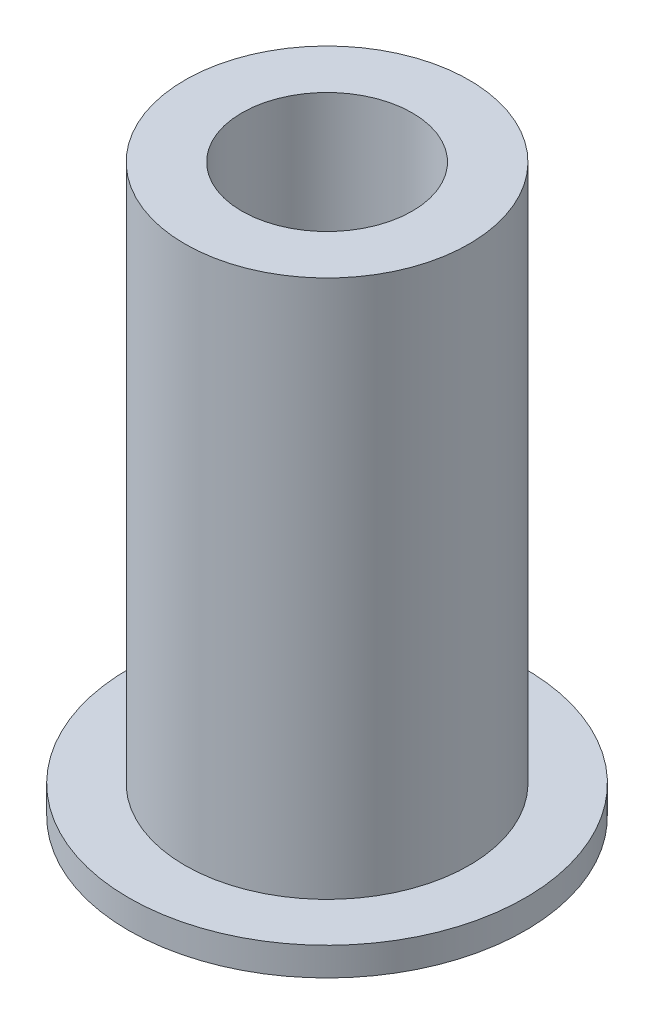
from build123d import *

# Parameters (mm, degrees)
SKETCH2_R           = 7.9629
SKETCH2_R_2         = 4.7752
BOSS_EXTRUDE1_DEPTH = 31.75
SKETCH3_R           = 11.1125
SKETCH3_R_2         = 7.9629
BOSS_EXTRUDE2_DEPTH = 1.5875


with BuildPart() as part:
    # Sketch2 → Boss-Extrude1 (new body)
    with BuildSketch(Plane(origin=(0, 0, 0), x_dir=(1, 0, 0), z_dir=(0, 1, 0))):
        with Locations(Location((0, 0, 0), (0, 0, 270))):
            Circle(SKETCH2_R)
        with Locations(Location((0, 0, 0), (0, 0, 270))):
            Circle(SKETCH2_R_2, mode=Mode.SUBTRACT)
    extrude(amount=BOSS_EXTRUDE1_DEPTH)

    # Sketch3 → Boss-Extrude2 (add)
    with BuildSketch(Plane(origin=(0, 0, 0), x_dir=(1, 0, 0), z_dir=(0, 1, 0))):
        with Locations(Location((0, 0, 0), (0, 0, 270))):
            Circle(SKETCH3_R)
        with Locations(Location((0, 0, 0), (0, 0, 270))):
            Circle(SKETCH3_R_2, mode=Mode.SUBTRACT)
    extrude(amount=BOSS_EXTRUDE2_DEPTH)


solid = part.part
